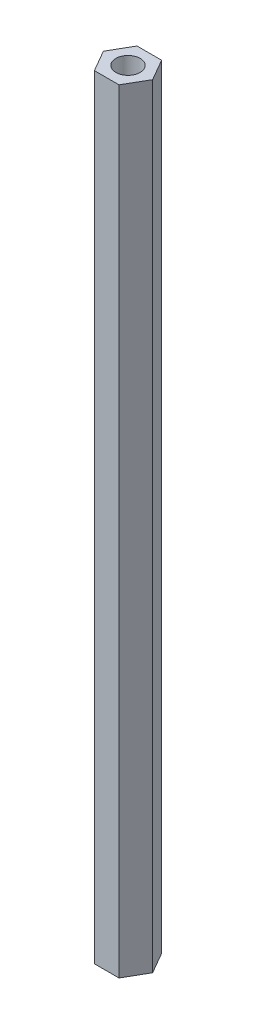
from build123d import *

# Parameters (mm, degrees)
SKETCH1_R           = 2
BOSS_EXTRUDE1_DEPTH = 127


with BuildPart() as part:
    # Sketch1 → Boss-Extrude1 (new body)
    with BuildSketch(Plane(origin=(0, 0, 0), x_dir=(1, 0, 0), z_dir=(0, 1, 0))):
        Polygon((2.020725942, 3.5), (-2.020725942, 3.5), (-4.041451884, 0), (-2.020725942, -3.5), (2.020725942, -3.5), (4.041451884, 0), align=None)
        with Locations(Location((0, 0, 0), (0, 0, 270))):
            Circle(SKETCH1_R, mode=Mode.SUBTRACT)
    extrude(amount=BOSS_EXTRUDE1_DEPTH)


solid = part.part
